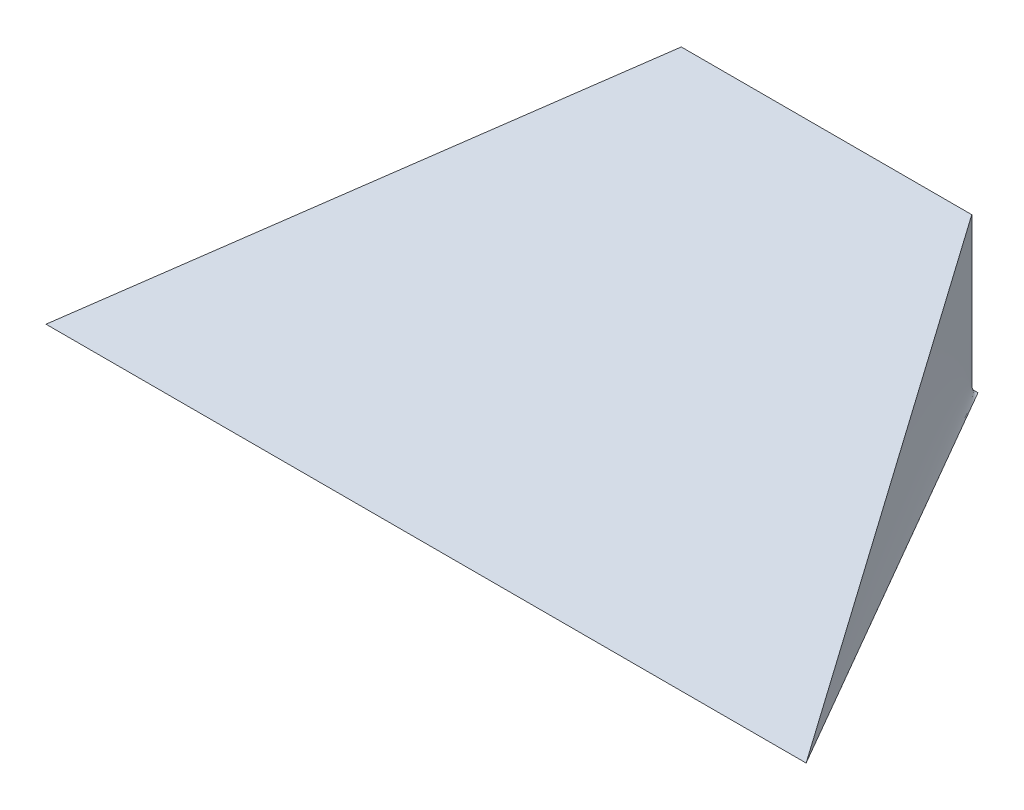
from build123d import *


with BuildPart() as part:
    # Esquisse1 → Lissage2 section 0
    with BuildSketch(Plane(origin=(0, 0, 0), x_dir=(1, 0, 0), z_dir=(0, 1, 0))):
        with BuildLine():
            Line((-38.518884599, -7), (-34.477432715, 0))
            Line((-34.477432715, 0), (-29.477432715, 0))
            Line((-29.477432715, 0), (-25.43598083, -7))
            Line((-25.43598083, -7), (-38.518884599, -7))
        make_face()
    # Esquisse2 → Lissage2 section 1
    with BuildSketch(Plane.XY):
        with BuildLine():
            Line((-34.584516886, 0), (-29.584516886, 0))
            Line((-29.584516886, 0), (-29.584516886, 2.6))
            Line((-29.584516886, 2.6), (-34.584516886, 2.6))
            Line((-34.584516886, 2.6), (-34.584516886, 0))
        make_face()
    loft()


solid = part.part
